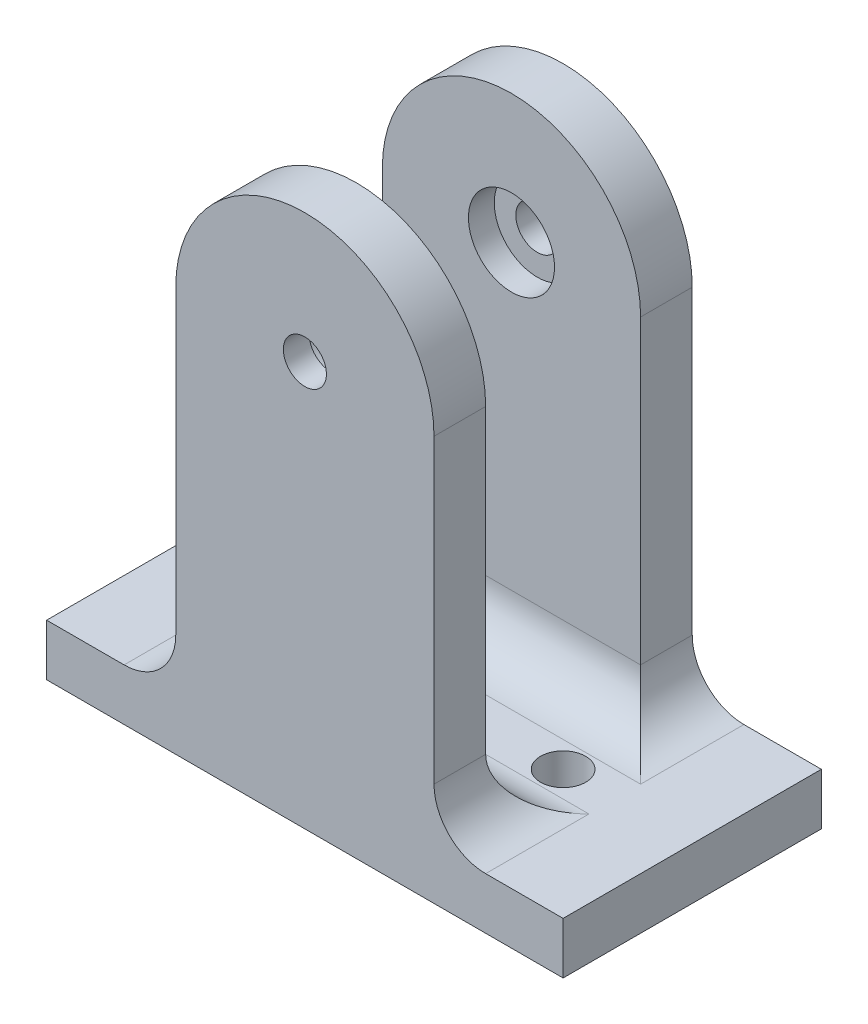
from build123d import *

# Parameters (mm, degrees)
SKETCH1_W            = 76.2
SKETCH1_H            = 38.1
SKETCH1_R            = 3.3274
BOSS_EXTRUDE1_DEPTH  = 7.62
SKETCH2_R            = 3.175
BOSS_EXTRUDE2_DEPTH  = 7.62
FILLET1_R            = 7.62
SKETCH3_R            = 6.35
CUT_EXTRUDE1_DEPTH   = 3.81
FILLET1_OF_MIRROR2_R = 7.62


with BuildPart() as part:
    # Sketch1 → Boss-Extrude1 (new body)
    with BuildSketch(Plane(origin=(0, 0, 0), x_dir=(1, 0, 0), z_dir=(0, 1, 0))):
        with Locations((38.1, 19.05)):
            Rectangle(SKETCH1_W, SKETCH1_H)
        with Locations(Location((19.05, 19.05, 0), (0, 0, 90))):
            Circle(SKETCH1_R, mode=Mode.SUBTRACT)
        with Locations(Location((57.15, 19.05, 0), (0, 0, 90))):
            Circle(SKETCH1_R, mode=Mode.SUBTRACT)
    extrude(amount=BOSS_EXTRUDE1_DEPTH)

    # Sketch2 → Boss-Extrude2 (add)
    with BuildSketch(Plane.XY):
        with BuildLine():
            Line((19.05, 7.62), (19.05, 59.69))
            ThreePointArc((19.05, 59.69), (38.1, 78.74), (57.15, 59.69))
            Line((57.15, 59.69), (57.15, 7.62))
            Line((57.15, 7.62), (19.05, 7.62))
        make_face()
        with Locations((38.1, 59.69)):
            Circle(SKETCH2_R, mode=Mode.SUBTRACT)
    boss_extrude2 = extrude(amount=-BOSS_EXTRUDE2_DEPTH)

    # Fillet1
    fillet1_edges = [part.edges().sort_by_distance(p)[0] for p in [
        (38.1, 7.62, -7.62),
        (57.15, 7.62, -3.81),
        (19.05, 7.62, -3.81),
    ]]
    fillet(fillet1_edges, radius=FILLET1_R)

    # Sketch3 → Cut-Extrude1 (cut)
    with BuildSketch(Plane(origin=(0, 0, -7.62), x_dir=(-1, 0, 0), z_dir=(0, 0, -1))):
        with Locations((-38.1, 59.69)):
            Circle(SKETCH3_R)
    cut_extrude1 = extrude(amount=-CUT_EXTRUDE1_DEPTH, mode=Mode.SUBTRACT)

    # Mirror2: Boss-Extrude2, Cut-Extrude1 across plane
    add(boss_extrude2.mirror(Plane.XY.offset(-19.05)))
    add(cut_extrude1.mirror(Plane.XY.offset(-19.05)), mode=Mode.SUBTRACT)

    # Fillet1 of Mirror2
    fillet1_of_mirror2_edges = [part.edges().sort_by_distance(p)[0] for p in [
        (38.1, 7.62, -30.48),
        (57.15, 7.62, -34.29),
        (19.05, 7.62, -34.29),
    ]]
    fillet(fillet1_of_mirror2_edges, radius=FILLET1_OF_MIRROR2_R)


solid = part.part
